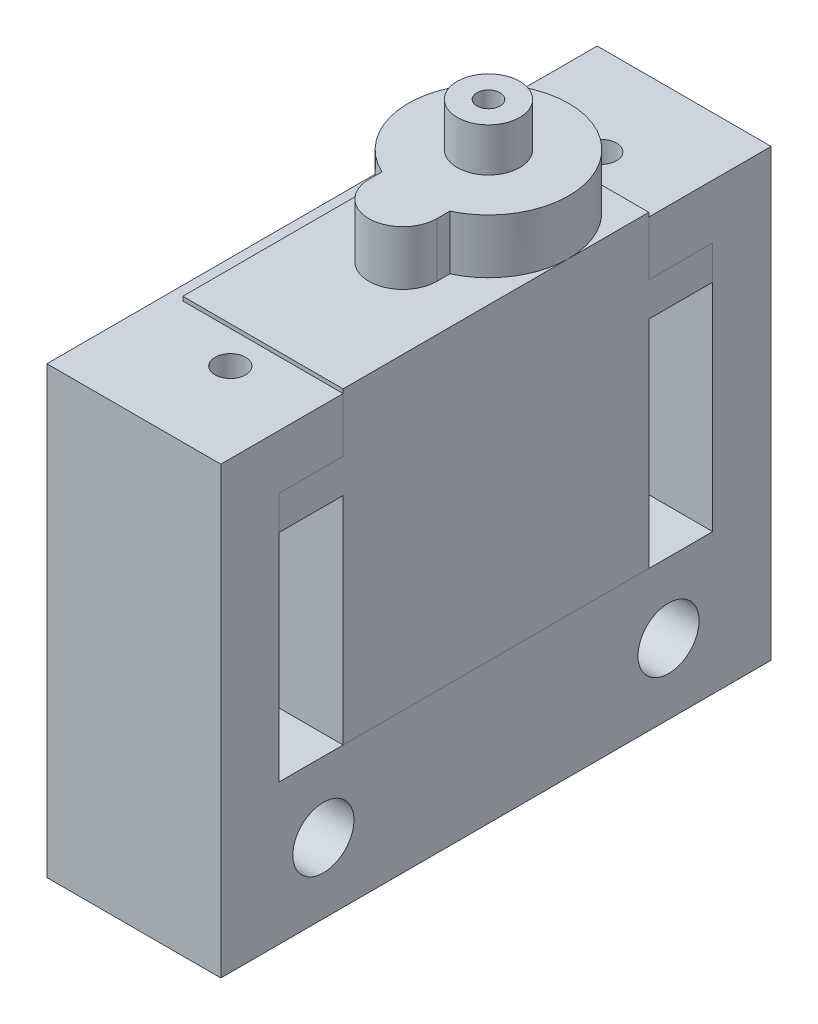
from build123d import *

# Parameters (mm, degrees)
BOSS_EXTRU_1_DEPTH      = 5.9
BOSS_EXTRU_1_DEPTH_BACK = 5.9
BOSS_EXTRU_2_DEPTH      = 4
ENL_V_MAT_EXTRU_1_DEPTH = 2.5
ESQUISSE4_R             = 2.3
ESQUISSE4_R_2           = 0.85
BOSS_EXTRU_3_DEPTH      = 3.2
SKETCH1_W               = 11.8
SKETCH1_H               = 9
SKETCH1_R               = 1.125
BOSS_EXTRUDE1_DEPTH     = 4
SKETCH3_W               = 11.8
SKETCH3_H               = 4.3
BOSS_EXTRUDE2_DEPTH     = 22.4
SKETCH5_W               = 11.8
SKETCH5_H               = 4
BOSS_EXTRUDE3_DEPTH     = 15.95
SKETCH6_W               = 11.8
SKETCH6_H               = 40.5
BOSS_EXTRUDE4_DEPTH     = 6.35
SKETCH7_R               = 2.2479
CUT_EXTRUDE1_DEPTH      = 35.487570225
SKETCH8_W               = 40.5
SKETCH8_H               = 32.75
SKETCH8_R               = 2.2479
BOSS_EXTRUDE5_DEPTH     = 1


with BuildPart() as part:
    # Esquisse1 → Boss.-Extru.1 (new, two sides: drawn at the far end of the back side and taken through both)
    with BuildSketch(Plane(origin=(0, 0, 0), x_dir=(0, 0, -1), z_dir=(1, 0, 0)).offset(-BOSS_EXTRU_1_DEPTH_BACK)):
        Polygon((-11.25, -14.95), (11.25, -14.95), (11.25, 0.95), (15.95, 0.95), (15.95, 3.45), (11.25, 3.45), (11.25, 7.75), (-11.25, 7.75), (-11.25, 3.45), (-15.95, 3.45), (-15.95, 0.95), (-11.25, 0.95), align=None)
    extrude(amount=BOSS_EXTRU_1_DEPTH + BOSS_EXTRU_1_DEPTH_BACK)

    # Esquisse2 → Boss.-Extru.2 (add)
    with BuildSketch(Plane(origin=(0, 7.75, 0), x_dir=(1, 0, 0), z_dir=(0, 1, 0))):
        with BuildLine():
            Line((-2.5, -0.95), (-2.5, 0.005844314))
            ThreePointArc((-2.5, 0.005844314), (0, 11.25), (2.5, 0.005844314))
            Line((2.5, 0.005844314), (2.5, -0.95))
            ThreePointArc((2.5, -0.95), (0, -3.45), (-2.5, -0.95))
        make_face()
    extrude(amount=BOSS_EXTRU_2_DEPTH)

    # Esquisse3 → Enlèv. mat.-Extru.1 (cut)
    with BuildSketch(Plane(origin=(0, 3.45, 0), x_dir=(1, 0, 0), z_dir=(0, 1, 0))):
        with BuildLine():
            Line((-0.65, 15.95), (-0.65, 14.409934208))
            ThreePointArc((-0.65, 14.409934208), (0, 12.65), (0.65, 14.409934208))
            Line((0.65, 14.409934208), (0.65, 15.95))
            Line((0.65, 15.95), (-0.65, 15.95))
        make_face()
        with BuildLine():
            Line((-0.65, -15.95), (0.65, -15.95))
            Line((0.65, -15.95), (0.65, -14.409934208))
            ThreePointArc((0.65, -14.409934208), (0, -12.65), (-0.65, -14.409934208))
            Line((-0.65, -14.409934208), (-0.65, -15.95))
        make_face()
    extrude(amount=-ENL_V_MAT_EXTRU_1_DEPTH, mode=Mode.SUBTRACT)

    # Esquisse4 → Boss.-Extru.3 (add)
    with BuildSketch(Plane(origin=(0, 11.75, 0), x_dir=(1, 0, 0), z_dir=(0, 1, 0))):
        with Locations(Location((0, 5.35, 0), (0, 0, 270))):
            Circle(ESQUISSE4_R)
        with Locations(Location((0, 5.35, 0), (0, 0, 270))):
            Circle(ESQUISSE4_R_2, mode=Mode.SUBTRACT)
    extrude(amount=BOSS_EXTRU_3_DEPTH)


with BuildPart() as body_2:
    # Sketch1 → Boss-Extrude1 (new body)
    with BuildSketch(Plane(origin=(0, 3.45, 0), x_dir=(1, 0, 0), z_dir=(0, 1, 0))):
        with Locations((0, -15.75)):
            Rectangle(SKETCH1_W, SKETCH1_H)
        with Locations(Location((0, -13.65, 0), (0, 0, 270))):
            Circle(SKETCH1_R, mode=Mode.SUBTRACT)
    boss_extrude1 = extrude(amount=BOSS_EXTRUDE1_DEPTH)


with BuildPart() as body_3:
    # Sketch3 → Boss-Extrude2 (new body)
    with BuildSketch(Plane.XZ.offset(-3.45)):
        with Locations((0, 18.1)):
            Rectangle(SKETCH3_W, SKETCH3_H)
    boss_extrude2 = extrude(amount=BOSS_EXTRUDE2_DEPTH)


with BuildPart() as body_4:
    # Sketch5 → Boss-Extrude3 (new body)
    with BuildSketch(Plane(origin=(0, 0, 15.95), x_dir=(-1, 0, 0), z_dir=(0, 0, -1))):
        with Locations((0, -16.95)):
            Rectangle(SKETCH5_W, SKETCH5_H)
    boss_extrude3 = extrude(amount=BOSS_EXTRUDE3_DEPTH)

    # Combine1: union body 3, body 2
    add(body_3.part)
    add(body_2.part)

    # Mirror3: Boss-Extrude1, Boss-Extrude2, Boss-Extrude3 across plane
    add(boss_extrude1.mirror(Plane(origin=(0, 0, 0), x_dir=(1, 0, 0), z_dir=(0, 0, -1))))
    add(boss_extrude2.mirror(Plane(origin=(0, 0, 0), x_dir=(1, 0, 0), z_dir=(0, 0, -1))))
    add(boss_extrude3.mirror(Plane(origin=(0, 0, 0), x_dir=(1, 0, 0), z_dir=(0, 0, -1))))

    # Sketch6 → Boss-Extrude4 (add)
    with BuildSketch(Plane.XZ.offset(18.95)):
        Rectangle(SKETCH6_W, SKETCH6_H)
    extrude(amount=BOSS_EXTRUDE4_DEPTH)

    # Sketch7 → Cut-Extrude1 (cut, through all)
    with BuildSketch(Plane.ZY.offset(5.9)):
        with Locations((12.7, -20.125)):
            Circle(SKETCH7_R)
        with Locations((-12.7, -20.125)):
            Circle(SKETCH7_R)
    extrude(amount=-CUT_EXTRUDE1_DEPTH, mode=Mode.SUBTRACT)

    # Sketch8 → Boss-Extrude5 (add)
    with BuildSketch(Plane.ZY.offset(5.9)):
        with Locations((0, -8.925)):
            Rectangle(SKETCH8_W, SKETCH8_H)
        with Locations((-12.7, -20.125)):
            Circle(SKETCH8_R, mode=Mode.SUBTRACT)
        with Locations((12.7, -20.125)):
            Circle(SKETCH8_R, mode=Mode.SUBTRACT)
    extrude(amount=BOSS_EXTRUDE5_DEPTH)


solid = Compound([part.part, body_4.part])
